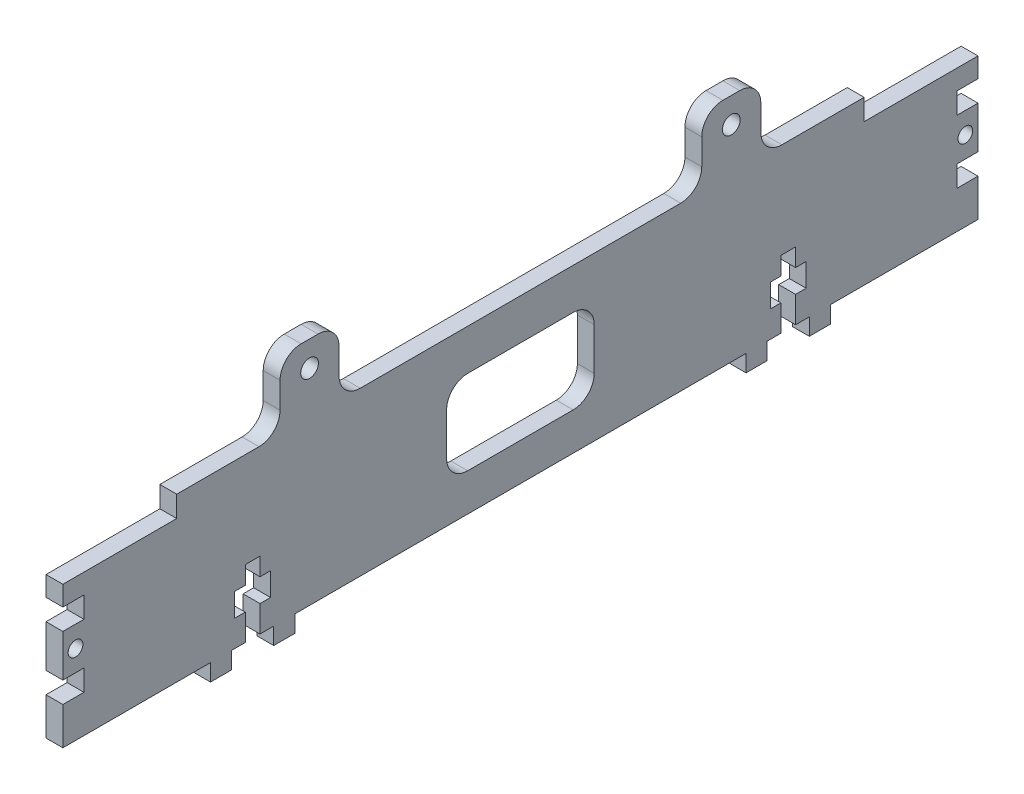
from build123d import *

# Parameters (mm, degrees)
ESBO_O1_R                = 1.75
RESSALTO_EXTRUS_O1_DEPTH = 4
ESBO_O2_W                = 35
ESBO_O2_H                = 20
CORTE_EXTRUS_O1_DEPTH    = 111.962426073
ESBO_O3_W                = 217
ESBO_O3_H                = 1.79
RESSALTO_EXTRUS_O2_DEPTH = 4
ESBO_O4_W                = 27
ESBO_O4_H                = 6
CORTE_EXTRUS_O2_DEPTH    = 111.962426073
ESBO_O5_W                = 163
ESBO_O5_H                = 1
CORTE_EXTRUS_O3_DEPTH    = 111.962426073
ESBO_O6_R                = 2.1
RESSALTO_EXTRUS_O4_DEPTH = 4
FILETE1_R                = 5
FILETE2_R                = 5


with BuildPart() as part:
    # Esboço1 → Ressalto-extrusão1 (new body)
    with BuildSketch(Plane(origin=(0, 0, 0), x_dir=(0, 0, -1), z_dir=(1, 0, 0))):
        Polygon((-108.5, 18.9), (108.5, 18.9), (108.5, 10), (103.5, 10), (103.5, 5), (108.5, 5), (108.5, -5), (103.5, -5), (103.5, -10), (108.5, -10), (108.5, -18.9), (73.5, -18.9), (73.5, -22.9), (68.5, -22.9), (68.5, -18.9), (65.25, -18.9), (65.25, -12.65), (67.75, -12.65), (67.75, -7.15), (65.25, -7.15), (65.25, -2.9), (61.75, -2.9), (61.75, -7.15), (59.25, -7.15), (59.25, -12.65), (61.75, -12.65), (61.75, -18.9), (58.5, -18.9), (58.5, -22.9), (53.5, -22.9), (53.5, -18.9), (-53.5, -18.9), (-53.5, -22.9), (-58.5, -22.9), (-58.5, -18.9), (-61.75, -18.9), (-61.75, -12.65), (-59.25, -12.65), (-59.25, -7.15), (-61.75, -7.15), (-61.75, -2.9), (-65.25, -2.9), (-65.25, -7.15), (-67.75, -7.15), (-67.75, -12.65), (-65.25, -12.65), (-65.25, -18.9), (-68.5, -18.9), (-68.5, -22.9), (-73.5, -22.9), (-73.5, -18.9), (-108.5, -18.9), (-108.5, -10), (-103.5, -10), (-103.5, -5), (-108.5, -5), (-108.5, 5), (-103.5, 5), (-103.5, 10), (-108.5, 10), align=None)
        with Locations((-105.5, 0)):
            Circle(ESBO_O1_R, mode=Mode.SUBTRACT)
        with Locations(Location((105.5, 0, 0), (0, 0, 180))):
            Circle(ESBO_O1_R, mode=Mode.SUBTRACT)
    extrude(amount=RESSALTO_EXTRUS_O1_DEPTH)

    # Esboço2 → Corte-extrusão1 (cut, through all)
    with BuildSketch(Plane(origin=(4, 0, 0), x_dir=(0, 0, -1), z_dir=(1, 0, 0))):
        Rectangle(ESBO_O2_W, ESBO_O2_H)
    extrude(amount=-CORTE_EXTRUS_O1_DEPTH, mode=Mode.SUBTRACT)

    # Esboço3 → Ressalto-extrusão2 (add, through all)
    with BuildSketch(Plane(origin=(4, 0, 0), x_dir=(0, 0, -1), z_dir=(1, 0, 0))):
        with Locations((0, 19.795)):
            Rectangle(ESBO_O3_W, ESBO_O3_H)
    extrude(amount=-RESSALTO_EXTRUS_O2_DEPTH)

    # Esboço4 → Corte-extrusão2 (cut, through all)
    with BuildSketch(Plane(origin=(4, 0, 0), x_dir=(0, 0, -1), z_dir=(1, 0, 0))):
        with Locations((-95, 17.69)):
            Rectangle(ESBO_O4_W, ESBO_O4_H)
        with Locations((95, 17.69)):
            Rectangle(ESBO_O4_W, ESBO_O4_H)
    extrude(amount=-CORTE_EXTRUS_O2_DEPTH, mode=Mode.SUBTRACT)

    # Esboço5 → Corte-extrusão3 (cut, through all)
    with BuildSketch(Plane(origin=(4, 0, 0), x_dir=(0, 0, -1), z_dir=(1, 0, 0))):
        with Locations((0, 20.19)):
            Rectangle(ESBO_O5_W, ESBO_O5_H)
    extrude(amount=-CORTE_EXTRUS_O3_DEPTH, mode=Mode.SUBTRACT)

    # Esboço6 → Ressalto-extrusão4 (add, through all)
    # profile 1 of 2: a face of its own
    with BuildSketch(Plane(origin=(4, 0, 0), x_dir=(0, 0, -1), z_dir=(1, 0, 0))):
        with BuildLine():
            Line((-57, 19.69), (-57, 30.82))
            ThreePointArc((-57, 30.82), (-55.535533906, 34.355533906), (-52, 35.82))
            Line((-52, 35.82), (-48, 35.82))
            ThreePointArc((-48, 35.82), (-44.464466094, 34.355533906), (-43, 30.82))
            Line((-43, 30.82), (-43, 19.69))
            Line((-43, 19.69), (-57, 19.69))
        make_face()
        with Locations((-50, 29.82)):
            Circle(ESBO_O6_R, mode=Mode.SUBTRACT)
    # profile 2 of 2: a face of its own
    with BuildSketch(Plane(origin=(4, 0, 0), x_dir=(0, 0, -1), z_dir=(1, 0, 0))):
        with BuildLine():
            Line((43, 30.82), (43, 19.69))
            Line((43, 19.69), (57, 19.69))
            Line((57, 19.69), (57, 30.82))
            ThreePointArc((57, 30.82), (55.535533906, 34.355533906), (52, 35.82))
            Line((52, 35.82), (48, 35.82))
            ThreePointArc((48, 35.82), (44.464466094, 34.355533906), (43, 30.82))
        make_face()
        with Locations(Location((50, 29.82, 0), (0, 0, 180))):
            Circle(ESBO_O6_R, mode=Mode.SUBTRACT)
    extrude(amount=-RESSALTO_EXTRUS_O4_DEPTH)

    # Filete1
    filete1_edges = [part.edges().sort_by_distance(p)[0] for p in [
        (2, 19.69, 43),
        (2, 19.69, 57),
        (2, 19.69, -57),
        (2, 19.69, -43),
    ]]
    fillet(filete1_edges, radius=FILETE1_R)

    # Filete2
    filete2_edges = [part.edges().sort_by_distance(p)[0] for p in [
        (2, 10, -17.5),
        (2, -10, -17.5),
        (2, -10, 17.5),
        (2, 10, 17.5),
    ]]
    fillet(filete2_edges, radius=FILETE2_R)


solid = part.part
